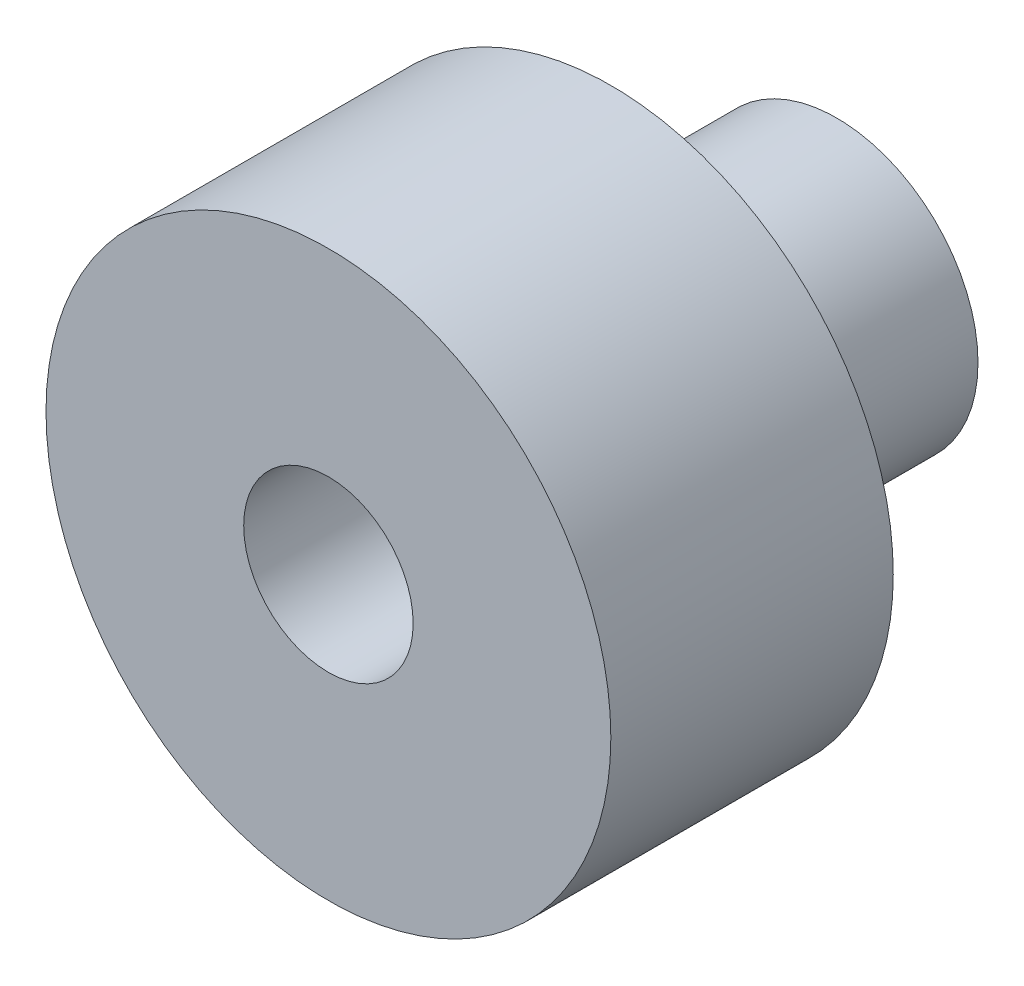
from build123d import *

# Parameters (mm, degrees)
SKETCH1_R           = 10
BOSS_EXTRUDE1_DEPTH = 10
SKETCH3_R           = 5
BOSS_EXTRUDE2_DEPTH = 8
SKETCH4_R           = 3
CUT_EXTRUDE1_DEPTH  = 27
SKETCH5_R           = 1.5
CUT_EXTRUDE2_DEPTH  = 27


with BuildPart() as part:
    # Sketch1 → Boss-Extrude1 (new body)
    with BuildSketch(Plane.XY):
        Circle(SKETCH1_R)
    extrude(amount=BOSS_EXTRUDE1_DEPTH)

    # Sketch3 → Boss-Extrude2 (add)
    with BuildSketch(Plane(origin=(0, 0, 0), x_dir=(-1, 0, 0), z_dir=(0, 0, -1))):
        with Locations(Location((0, 0, 0), (0, 0, 180))):
            Circle(SKETCH3_R)
    extrude(amount=BOSS_EXTRUDE2_DEPTH)

    # Sketch4 → Cut-Extrude1 (cut)
    with BuildSketch(Plane(origin=(0, 0, -8), x_dir=(-1, 0, 0), z_dir=(0, 0, -1))):
        Circle(SKETCH4_R)
    extrude(amount=-CUT_EXTRUDE1_DEPTH, mode=Mode.SUBTRACT)

    # Sketch5 → Cut-Extrude2 (cut)
    with BuildSketch(Plane(origin=(0, 0, 0), x_dir=(1, 0, 0), z_dir=(0, 1, 0))):
        with Locations(Location((0, 5, 0), (0, 0, 270))):
            Circle(SKETCH5_R)
    extrude(amount=-CUT_EXTRUDE2_DEPTH, mode=Mode.SUBTRACT)


solid = part.part
